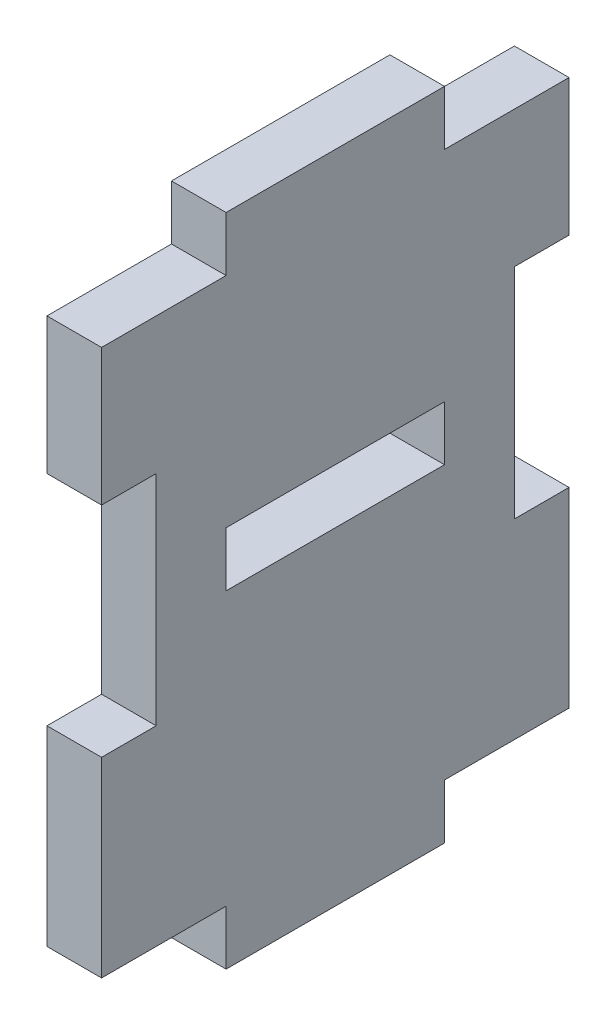
from build123d import *

# Parameters (mm, degrees)
SKETCH1_W      = 25.4
SKETCH1_H      = 6.35
EXTRUDE1_DEPTH = 6.35


with BuildPart() as part:
    # Sketch1 → Extrude1 (new body)
    with BuildSketch(Plane(origin=(0, 0, 0), x_dir=(0, 0, -1), z_dir=(1, 0, 0))):
        Polygon((14.478, 0), (14.478, 6.35), (0, 6.35), (0, 28.575), (6.35, 28.575), (6.35, 53.975), (0, 53.975), (0, 69.85), (14.478, 69.85), (14.478, 76.2), (39.878, 76.2), (39.878, 69.85), (54.356, 69.85), (54.356, 53.975), (48.006, 53.975), (48.006, 28.575), (54.356, 28.575), (54.356, 6.35), (39.878, 6.35), (39.878, 0), align=None)
        with Locations((27.178, 41.275)):
            Rectangle(SKETCH1_W, SKETCH1_H, mode=Mode.SUBTRACT)
    extrude(amount=EXTRUDE1_DEPTH)


solid = part.part
